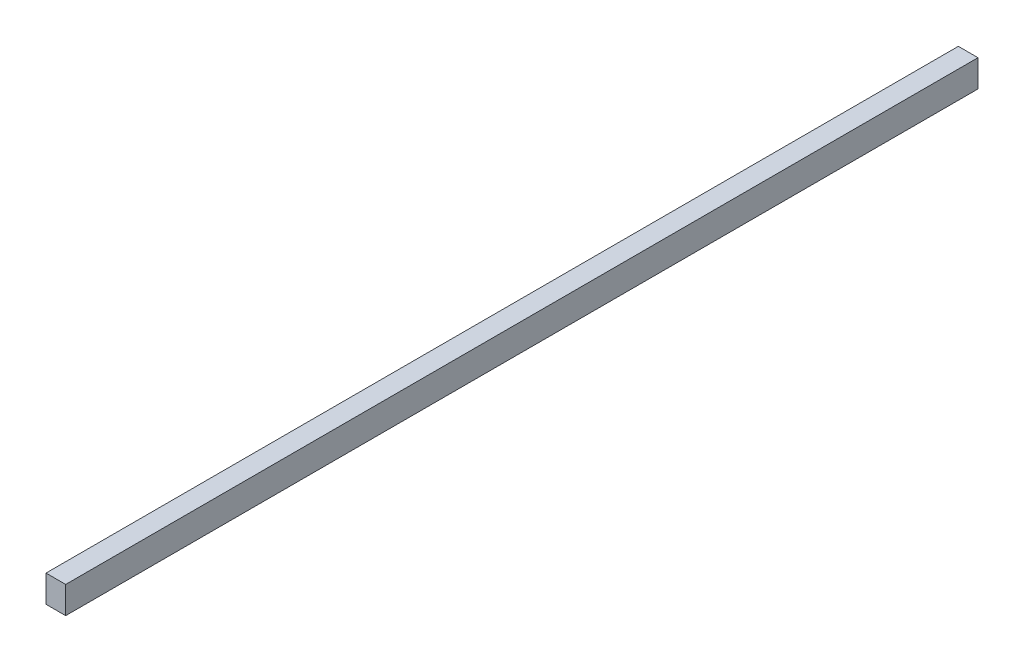
from build123d import *

# Parameters (mm, degrees)
SKETCH1_W           = 7.9375
SKETCH1_H           = 10.922
BOSS_EXTRUDE1_DEPTH = 368.046


with BuildPart() as part:
    # Sketch1 → Boss-Extrude1 (new body)
    with BuildSketch(Plane.XY):
        with Locations((3.96875, 5.461)):
            Rectangle(SKETCH1_W, SKETCH1_H)
    extrude(amount=-BOSS_EXTRUDE1_DEPTH)


solid = part.part
